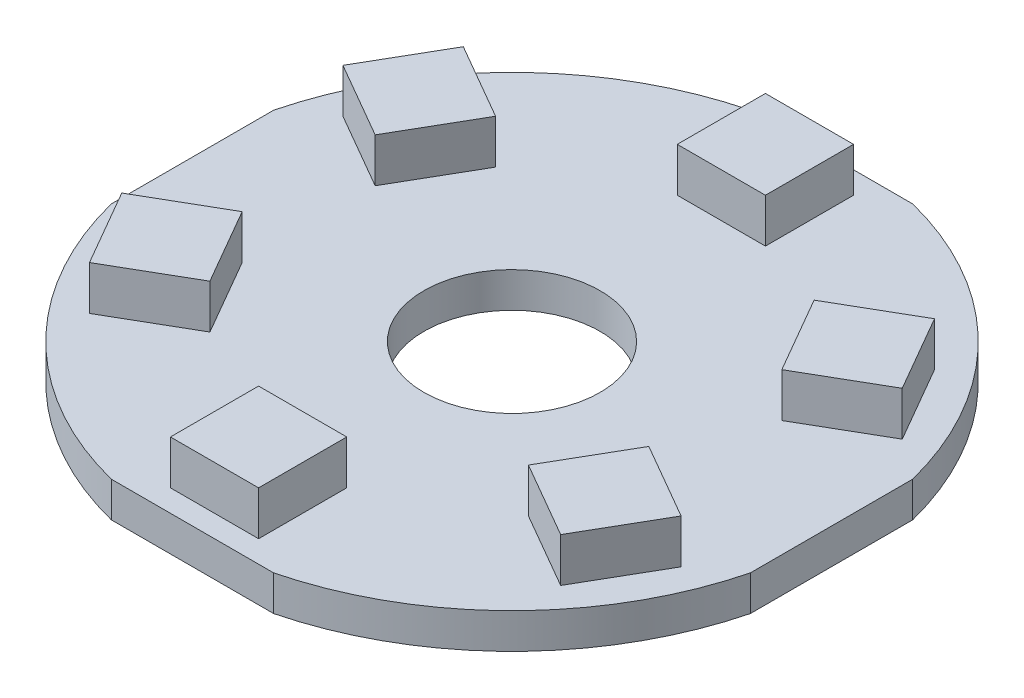
from build123d import *

# Parameters (mm, degrees)
SKETCH1_R           = 19
SKETCH1_R_2         = 5.08
BOSS_EXTRUDE1_DEPTH = 2.032
CUT_EXTRUDE1_DEPTH  = 27.946781329
CIRPATTERN1_COUNT   = 2
CIRPATTERN1_ANGLE   = 90
SKETCH3_W           = 5.08
SKETCH3_H           = 5.08
BOSS_EXTRUDE2_DEPTH = 2.54
CIRPATTERN2_COUNT   = 6


with BuildPart() as part:
    # Sketch1 → Boss-Extrude1 (new body)
    with BuildSketch(Plane(origin=(0, 0, 0), x_dir=(1, 0, 0), z_dir=(0, 1, 0))):
        with Locations(Location((0, 0, 0), (0, 0, 270))):
            Circle(SKETCH1_R)
        with Locations(Location((0, 0, 0), (0, 0, 270))):
            Circle(SKETCH1_R_2, mode=Mode.SUBTRACT)
    extrude(amount=BOSS_EXTRUDE1_DEPTH)

    # Sketch2 → Cut-Extrude1 (cut, through all)
    with BuildSketch(Plane(origin=(0, 2.032, 0), x_dir=(1, 0, 0), z_dir=(0, 1, 0))):
        with BuildLine():
            Line((-4.678437239, 18.415), (4.678437239, 18.415))
            ThreePointArc((4.678437239, 18.415), (0, 19), (-4.678437239, 18.415))
        make_face()
        with BuildLine():
            Line((-4.678437239, -18.415), (4.678437239, -18.415))
            ThreePointArc((4.678437239, -18.415), (0, -19), (-4.678437239, -18.415))
        make_face()
    cut_extrude1 = extrude(amount=-CUT_EXTRUDE1_DEPTH, mode=Mode.SUBTRACT)

    # CirPattern1: Cut-Extrude1 ×2 about axis
    cirpattern1_axis = Axis((0, 2.032, 0), (0, -1, 0))
    for i in range(1, CIRPATTERN1_COUNT):
        add(cut_extrude1.rotate(cirpattern1_axis, i * CIRPATTERN1_ANGLE / (CIRPATTERN1_COUNT - 1)), mode=Mode.SUBTRACT)

    # Sketch3 → Boss-Extrude2 (add)
    with BuildSketch(Plane(origin=(0, 2.032, 0), x_dir=(1, 0, 0), z_dir=(0, 1, 0))):
        with Locations((0, 14.605)):
            Rectangle(SKETCH3_W, SKETCH3_H)
    boss_extrude2 = extrude(amount=BOSS_EXTRUDE2_DEPTH)

    # CirPattern2: Boss-Extrude2 ×6 about axis
    cirpattern2_axis = Axis((0, 0, 0), (0, 1, 0))
    for i in range(1, CIRPATTERN2_COUNT):
        add(boss_extrude2.rotate(cirpattern2_axis, i * 360 / CIRPATTERN2_COUNT))


solid = part.part
